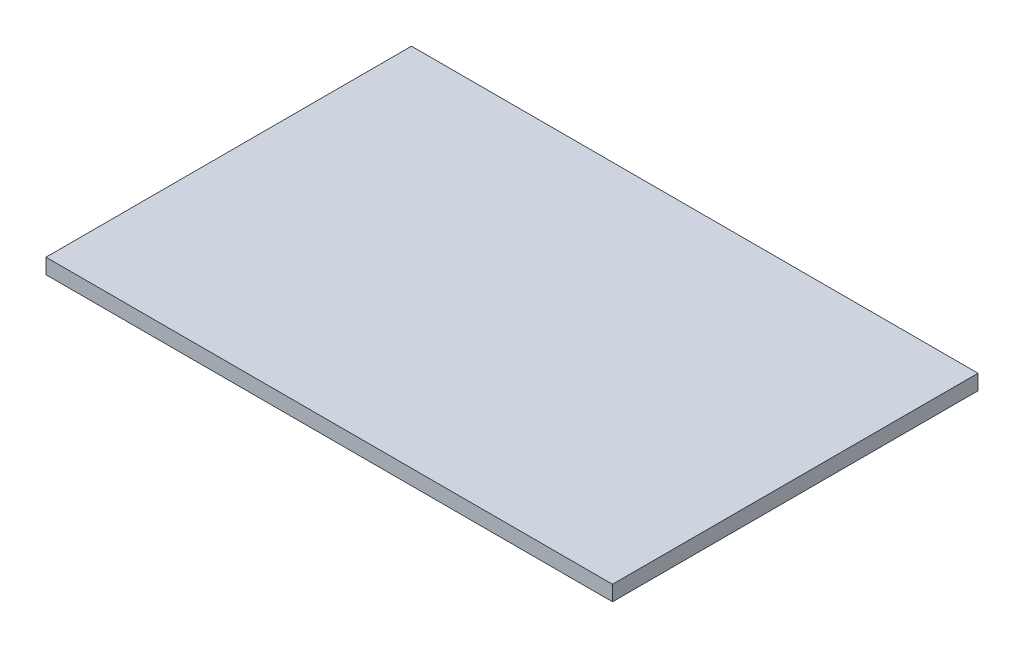
from build123d import *

# Parameters (mm, degrees)
SKETCH1_W           = 186
SKETCH1_H           = 120
BOSS_EXTRUDE1_DEPTH = 5


with BuildPart() as part:
    # Sketch1 → Boss-Extrude1 (new body)
    with BuildSketch(Plane(origin=(0, 0, 0), x_dir=(1, 0, 0), z_dir=(0, 1, 0))):
        with Locations((93, 60)):
            Rectangle(SKETCH1_W, SKETCH1_H)
    extrude(amount=BOSS_EXTRUDE1_DEPTH)


solid = part.part
